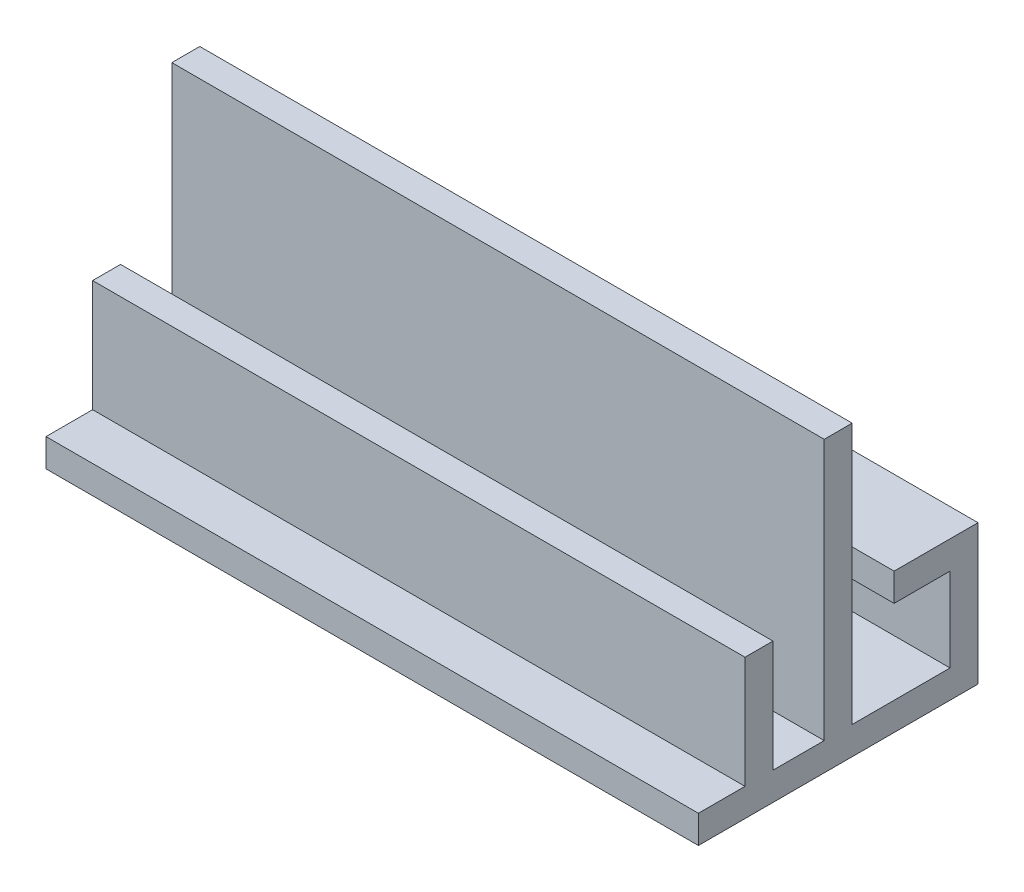
from build123d import *

# Parameters (mm, degrees)
EXTRUDE_1_DEPTH = 70


with BuildPart() as part:
    # Эскиз1 → Бобышка-Вытянуть1 (new body)
    with BuildSketch(Plane(origin=(0, 0, 0), x_dir=(0, 0, -1), z_dir=(1, 0, 0))):
        Polygon((6, 10.5), (12, 10.5), (12, 1.5), (1.5, 1.5), (1.5, 29.5), (-1.5, 29.5), (-1.5, 1.5), (-7, 1.5), (-7, 13.5), (-10, 13.5), (-10, 1.5), (-15, 1.5), (-15, -1.5), (15, -1.5), (15, 13.5), (6, 13.5), align=None)
    extrude(amount=EXTRUDE_1_DEPTH)


solid = part.part
